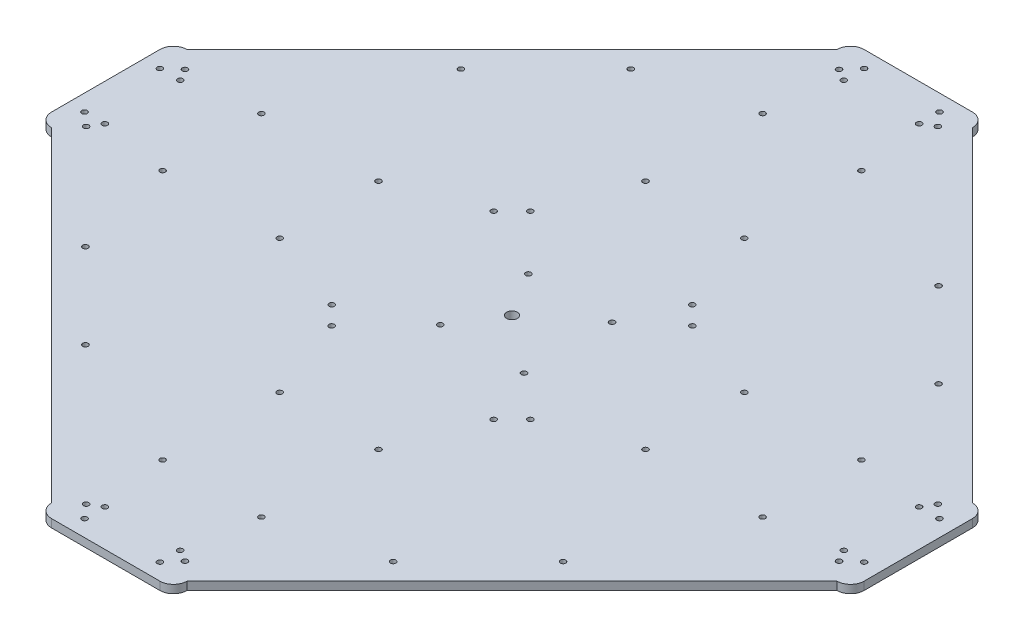
from build123d import *

# Parameters (mm, degrees)
BOSS_EXTRUDE1_DEPTH       = 6
SKETCH4_R                 = 0.495653738
CUT_EXTRUDE3_DEPTH        = 10
BOSS_EXTRUDE3_DEPTH       = 6
SKETCH6_R                 = 2
SKETCH6_R_2               = 4
CUT_EXTRUDE4_DEPTH        = 12
CIRPATTERN1_COUNT         = 4
BOSS_EXTRUDE4_DEPTH       = 6
F_4_0MM_DOWEL_HOLE4_D     = 4
F_4_0MM_DOWEL_HOLE4_DEPTH = 98.31
F_4_0MM_DOWEL_HOLE4_TIP   = 1.201721238
F_4_0MM_DOWEL_HOLE5_D     = 4
F_4_0MM_DOWEL_HOLE5_DEPTH = 98.31
F_4_0MM_DOWEL_HOLE5_TIP   = 1.201721238


with BuildPart() as part:
    # Sketch1 → Boss-Extrude1 (new body)
    with BuildSketch(Plane(origin=(0, 0, 0), x_dir=(1, 0, 0), z_dir=(0, 1, 0))):
        with BuildLine():
            Line((-110, 50), (-300, 50))
            ThreePointArc((-300, 50), (-307.071067812, 47.071067812), (-310, 40))
            Line((-310, 40), (-310, -40))
            ThreePointArc((-310, -40), (-307.071067812, -47.071067812), (-300, -50))
            Line((-300, -50), (-110, -50))
            Line((-110, -50), (-60, -100))
            Line((-60, -100), (-60, -290))
            ThreePointArc((-60, -290), (-57.071067812, -297.071067812), (-50, -300))
            Line((-50, -300), (30, -300))
            ThreePointArc((30, -300), (37.071067812, -297.071067812), (40, -290))
            Line((40, -290), (40, -100))
            Line((40, -100), (90, -50))
            Line((90, -50), (280, -50))
            ThreePointArc((280, -50), (287.071067812, -47.071067812), (290, -40))
            Line((290, -40), (290, 40))
            ThreePointArc((290, 40), (287.071067812, 47.071067812), (280, 50))
            Line((280, 50), (90, 50))
            Line((90, 50), (40, 100))
            Line((40, 100), (40, 290))
            ThreePointArc((40, 290), (37.071067812, 297.071067812), (30, 300))
            Line((30, 300), (-50, 300))
            ThreePointArc((-50, 300), (-57.071067812, 297.071067812), (-60, 290))
            Line((-60, 290), (-60, 100))
            Line((-60, 100), (-110, 50))
        make_face()
    extrude(amount=BOSS_EXTRUDE1_DEPTH)

    # Sketch4 → Cut-Extrude3 (cut)
    with BuildSketch(Plane(origin=(0, 6, 0), x_dir=(1, 0, 0), z_dir=(0, 1, 0))):
        with Locations(Location((-10, 0, 0), (0, 0, 270))):
            Circle(SKETCH4_R)
    extrude(amount=-CUT_EXTRUDE3_DEPTH, mode=Mode.SUBTRACT)

    # Sketch5 → Boss-Extrude3 (add)
    with BuildSketch(Plane(origin=(0, 6, 0), x_dir=(1, 0, 0), z_dir=(0, 1, 0))):
        Polygon((-300, 50), (-60, 290), (-60, 240), (-250, 50), align=None)
        Polygon((40, 290), (280, 50), (230, 50), (40, 240), align=None)
        Polygon((280, -50), (40, -290), (40, -240), (230, -49.07797178), align=None)
        Polygon((-300, -50), (-60, -290), (-60, -240), (-250, -50), align=None)
    extrude(amount=-BOSS_EXTRUDE3_DEPTH)

    # Sketch6 → Cut-Extrude4 (cut)
    with BuildSketch(Plane(origin=(0, 6, 0), x_dir=(1, 0, 0), z_dir=(0, 1, 0))):
        with Locations(Location((-37.824146891, 287.83697558, 0), (0, 0, 270))):
            Circle(SKETCH6_R)
        with Locations(Location((-37.824146891, 272.83697558, 0), (0, 0, 270))):
            Circle(SKETCH6_R)
        with Locations(Location((-46.483109463, 221.536893944, 0), (0, 0, 270))):
            Circle(SKETCH6_R)
        with Locations(Location((-46.483109463, 135.06793836, 0), (0, 0, 270))):
            Circle(SKETCH6_R)
        with Locations(Location((-69.817594081, 73.334484618, 0), (0, 0, 270))):
            Circle(SKETCH6_R)
        with Locations(Location((49.817594081, 73.334484618, 0), (0, 0, 270))):
            Circle(SKETCH6_R)
        with Locations(Location((26.483109463, 135.06793836, 0), (0, 0, 270))):
            Circle(SKETCH6_R)
        with Locations(Location((26.483109463, 221.536893944, 0), (0, 0, 270))):
            Circle(SKETCH6_R)
        with Locations(Location((191.360389693, 113.639610307, 0), (0, 0, 270))):
            Circle(SKETCH6_R)
        with Locations(Location((128.639610307, 176.360389693, 0), (0, 0, 270))):
            Circle(SKETCH6_R)
        with Locations(Location((17.824146891, 272.83697558, 0), (0, 0, 270))):
            Circle(SKETCH6_R)
        with Locations(Location((17.824146891, 287.83697558, 0), (0, 0, 270))):
            Circle(SKETCH6_R)
        with Locations(Location((-10, 0, 0), (0, 0, 270))):
            Circle(SKETCH6_R_2)
    cut_extrude4 = extrude(amount=-CUT_EXTRUDE4_DEPTH, mode=Mode.SUBTRACT)

    # CirPattern1: Cut-Extrude4 ×4 about axis
    cirpattern1_axis = Axis((-10, 0, 0), (0, 1, 0))
    for i in range(1, CIRPATTERN1_COUNT):
        add(cut_extrude4.rotate(cirpattern1_axis, i * 360 / CIRPATTERN1_COUNT), mode=Mode.SUBTRACT)

    # Sketch7 → Boss-Extrude4 (add)
    with BuildSketch(Plane(origin=(0, 6, 0), x_dir=(1, 0, 0), z_dir=(0, 1, 0))):
        Polygon((40, 240), (230, 50), (90, 50), (40, 100), align=None)
        Polygon((90, -50), (229.082424571, -50), (40, -240), (40, -100), align=None)
        Polygon((-60, 240), (-60, 100), (-110, 50), (-250, 50), align=None)
        Polygon((-110, -50), (-60, -100), (-60, -240), (-250, -50), align=None)
    extrude(amount=-BOSS_EXTRUDE4_DEPTH)

    # Ø4.0mm Dowel Hole4
    with Locations(Plane(origin=(0, 0, 0), x_dir=(-1, 0, 0), z_dir=(0, -1, 0))):
        with Locations((46.483109463, -278), (-26.483109463, -278), (-268, -36.483109463), (-268, 36.483109463), (-26.483109463, 278), (46.483109463, 278), (288, 36.483109463), (288, -36.483109463)):
            Hole(F_4_0MM_DOWEL_HOLE4_D / 2, depth=F_4_0MM_DOWEL_HOLE4_DEPTH)
            with Locations((0, 0, -(F_4_0MM_DOWEL_HOLE4_DEPTH + F_4_0MM_DOWEL_HOLE4_TIP / 2))):  # 118° drill point
                Cone(0, F_4_0MM_DOWEL_HOLE4_D / 2, F_4_0MM_DOWEL_HOLE4_TIP, mode=Mode.SUBTRACT)

    # Ø4.0mm Dowel Hole5
    with Locations(Plane(origin=(0, 6, 0), x_dir=(1, 0, 0), z_dir=(0, 1, 0))):
        with Locations((-30.430566073, -32.5), (31.383083735, -32.5), (31.383083735, 32.5), (-30.430566073, 32.5)):
            Hole(F_4_0MM_DOWEL_HOLE5_D / 2, depth=F_4_0MM_DOWEL_HOLE5_DEPTH)
            with Locations((0, 0, -(F_4_0MM_DOWEL_HOLE5_DEPTH + F_4_0MM_DOWEL_HOLE5_TIP / 2))):  # 118° drill point
                Cone(0, F_4_0MM_DOWEL_HOLE5_D / 2, F_4_0MM_DOWEL_HOLE5_TIP, mode=Mode.SUBTRACT)


solid = part.part
